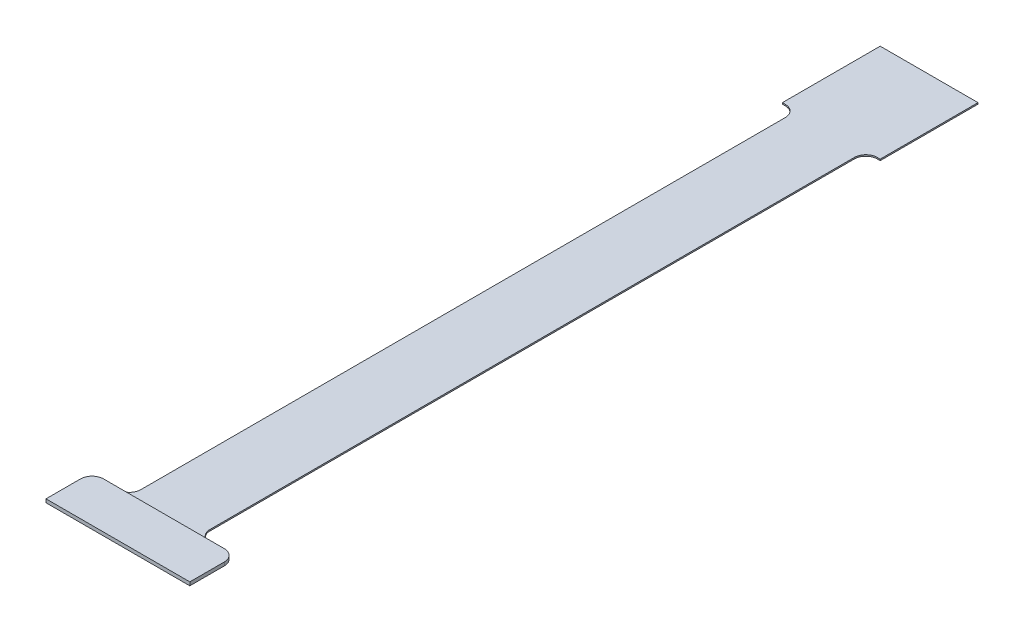
from build123d import *

# Parameters (mm, degrees)
BOSS_EXTRUDE1_DEPTH = 0.12
SKETCH2_W           = 12.5
SKETCH2_H           = 4
BOSS_EXTRUDE2_DEPTH = 0.18
FILLET1_R           = 1


with BuildPart() as part:
    # Sketch1 → Boss-Extrude1 (new body)
    with BuildSketch(Plane(origin=(0, 0, 0), x_dir=(1, 0, 0), z_dir=(0, 1, 0))):
        Polygon((-4.25, 0), (4.25, 0), (4.25, -8.5), (3, -8.5), (3, -66.5), (6.25, -66.5), (6.25, -70.5), (-6.25, -70.5), (-6.25, -66.5), (-3, -66.5), (-3, -8.5), (-4.25, -8.5), align=None)
    extrude(amount=BOSS_EXTRUDE1_DEPTH)

    # Sketch2 → Boss-Extrude2 (add)
    with BuildSketch(Plane(origin=(0, 0.12, 0), x_dir=(1, 0, 0), z_dir=(0, 1, 0))):
        with Locations((0, -68.5)):
            Rectangle(SKETCH2_W, SKETCH2_H)
    extrude(amount=BOSS_EXTRUDE2_DEPTH)

    # Fillet1
    fillet1_edges = [part.edges().sort_by_distance(p)[0] for p in [
        (3, 0.06, 8.5),
        (3, 0.06, 66.5),
        (6.25, 0.15, 66.5),
        (-6.25, 0.15, 66.5),
        (-3, 0.06, 66.5),
        (-3, 0.06, 8.5),
    ]]
    fillet(fillet1_edges, radius=FILLET1_R)


solid = part.part
